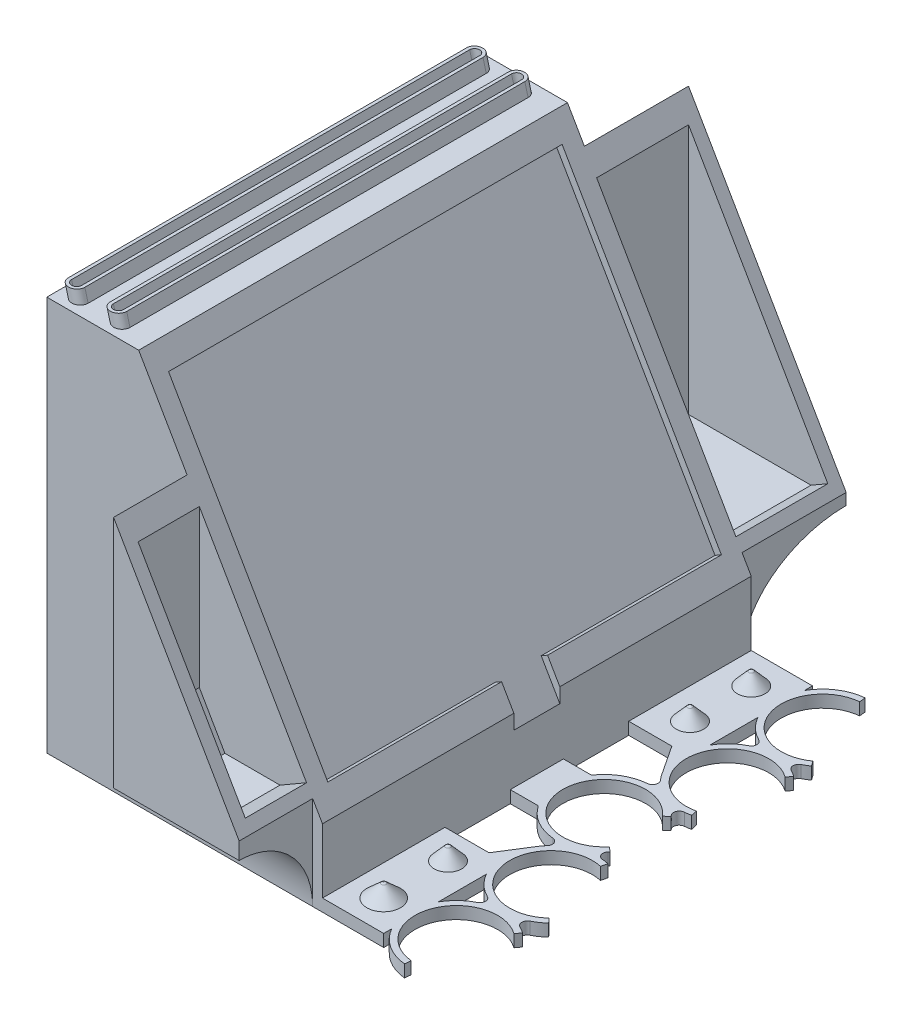
from build123d import *

# Parameters (mm, degrees)
BOSS_EXTRUDE1_DEPTH  = 140
CUT_EXTRUDE1_DEPTH   = 2.4
BOSS_EXTRUDE2_DEPTH  = 30
BOSS_EXTRUDE3_DEPTH  = 4
BOSS_EXTRUDE4_DEPTH  = 20
BOSS_EXTRUDE7_DEPTH  = 4
BOSS_EXTRUDE5_REACH  = 229.194
SKETCH6_W            = 41
SKETCH6_H            = 24
BOSS_EXTRUDE6_REACH  = 229.194
SKETCH7_W            = 51.473720558
SKETCH7_H            = 34
SKETCH12_RX          = 25
SKETCH12_RY          = 24
SKETCH12_RX_2        = 34
SKETCH12_RY_2        = 26.5
CUT_EXTRUDE3_DEPTH   = 80
SKETCH13_W           = 20
SKETCH13_H           = 40
BOSS_EXTRUDE9_DEPTH  = 4
SKETCH15_R           = 5.5
SKETCH15_R_2         = 4.5
BOSS_EXTRUDE11_DEPTH = 4.5
FILLET2_R            = 1
SKETCH22_W           = 35.526279442
SKETCH22_H           = 17.579224782
BOSS_EXTRUDE12_DEPTH = 10
CUT_EXTRUDE4_REACH   = 256.251
BOSS_EXTRUDE13_REACH = 256.251
SKETCH24_W           = 45.956632922
SKETCH24_H           = 155.115839264
CUT_EXTRUDE5_DEPTH   = 6
SKETCH25_W           = 35.526279442
SKETCH25_H           = 17.579224782
CUT_EXTRUDE6_DEPTH   = 10
BOSS_EXTRUDE14_DEPTH = 4


with BuildPart() as part:
    # Sketch1 → Boss-Extrude1 (new body)
    with BuildSketch(Plane.XY):
        Polygon((0, 0), (90, 0), (90, 25), (30, 128.923048454), (0, 128.923048454), align=None)
    extrude(amount=BOSS_EXTRUDE1_DEPTH)

    # Sketch2 → Cut-Extrude1 (cut)
    with BuildSketch(Plane(origin=(78.325317547, 45.22114317, 0), x_dir=(0, 0, -1), z_dir=(0.8660254037844362, 0.5000000000000046, 0))):
        Polygon((-5.75, 88.650635095), (-134.25, 88.650635095), (-134.25, -15.349364905), (-77.5, -15.349364905), (-77.5, -30.349364905), (-62.5, -30.349364905), (-62.5, -15.349364905), (-5.75, -15.349364905), align=None)
    extrude(amount=-CUT_EXTRUDE1_DEPTH, mode=Mode.SUBTRACT)

    # Sketch3 → Boss-Extrude2 (add)
    with BuildSketch(Plane(origin=(0, 0, 0), x_dir=(-1, 0, 0), z_dir=(0, 0, -1))):
        Polygon((-85, 33.660254038), (-79.526279442, 30.5), (-39.526279442, 30.5), (-39.526279442, 112.423048454), (-35.526279442, 119.351251684), (-35.526279442, 112.423048454), (-35.526279442, 26.5), (-80.598076211, 26.5), (-87, 30.196152423), align=None)
    extrude(amount=BOSS_EXTRUDE2_DEPTH)

    # Sketch4 → Boss-Extrude3 (add)
    with BuildSketch(Plane(origin=(0, 0, -30), x_dir=(-1, 0, 0), z_dir=(0, 0, -1))):
        Polygon((-87, 30.196152423), (-35.526279442, 119.351251684), (-35.526279442, 26.5), (-80.598076211, 26.5), align=None)
    extrude(amount=BOSS_EXTRUDE3_DEPTH)

    # Sketch5 → Boss-Extrude4 (add)
    with BuildSketch(Plane.XY.offset(140)):
        Polygon((84.803847577, 34), (76.143593539, 29), (58.143593539, 29), (49.803847577, 43.444863729), (49.803847577, 94.621778265), (45.803847577, 101.549981495), (45.803847577, 94.621778265), (45.803847577, 42.373066959), (55.834192463, 25), (77.215390309, 25), (86.803847577, 30.535898385), align=None)
    extrude(amount=BOSS_EXTRUDE4_DEPTH)

    # Sketch9 → Boss-Extrude7 (add)
    with BuildSketch(Plane.XY.offset(160)):
        Polygon((45.803847577, 101.549981495), (45.803847577, 42.373066959), (55.834192463, 25), (77.215390309, 25), (86.803847577, 30.535898385), align=None)
    extrude(amount=BOSS_EXTRUDE7_DEPTH)

    # Sketch6 → Boss-Extrude5 (add, up to next)
    with BuildSketch(Plane(origin=(0, 0, 0), x_dir=(-1, 0, 0), z_dir=(0, -1, 0)), mode=Mode.PRIVATE) as boss_extrude5_sk1:
        with Locations((-66.303847577, -152)):
            Rectangle(SKETCH6_W, SKETCH6_H)
    boss_extrude5_tool1 = extrude(boss_extrude5_sk1.sketch, amount=-BOSS_EXTRUDE5_REACH, mode=Mode.PRIVATE) - part.part
    add(boss_extrude5_tool1.solids().sort_by_distance((66.303848, 0, 152))[0])

    # Sketch7 → Boss-Extrude6 (add, up to next)
    with BuildSketch(Plane.XZ, mode=Mode.PRIVATE) as boss_extrude6_sk1:
        with Locations((61.263139721, -17)):
            Rectangle(SKETCH7_W, SKETCH7_H)
    boss_extrude6_tool1 = extrude(boss_extrude6_sk1.sketch, amount=-BOSS_EXTRUDE6_REACH, mode=Mode.PRIVATE) - part.part
    add(boss_extrude6_tool1.solids().sort_by_distance((61.26314, 0, -17))[0])

    # Sketch12 → Cut-Extrude3 (cut)
    with BuildSketch(Plane(origin=(90, 0, 0), x_dir=(0, 0, -1), z_dir=(1, 0, 0))):
        with Locations(Location((-164, 0), (0, 0, 90))):
            Ellipse(SKETCH12_RX, SKETCH12_RY)
        with Locations(Location((34, 0), (0, 0, 180))):
            Ellipse(SKETCH12_RX_2, SKETCH12_RY_2)
    extrude(amount=-CUT_EXTRUDE3_DEPTH, mode=Mode.SUBTRACT)

    # Sketch13 → Boss-Extrude9 (add)
    with BuildSketch(Plane(origin=(0, 0, 0), x_dir=(1, 0, 0), z_dir=(0, 1, 0))):
        with Locations((100, -120)):
            Rectangle(SKETCH13_W, SKETCH13_H)
        with Locations((100, -20)):
            Rectangle(SKETCH13_W, SKETCH13_H)
    extrude(amount=BOSS_EXTRUDE9_DEPTH)

    # Sketch15 → Boss-Extrude11 (add)
    with BuildSketch(Plane(origin=(0, 4, 0), x_dir=(1, 0, 0), z_dir=(0, 1, 0))):
        with Locations((100, -130)):
            Circle(SKETCH15_R)
        with Locations((100, -109)):
            Circle(SKETCH15_R_2)
        with Locations((100, -30)):
            Circle(SKETCH15_R_2)
        with Locations((100, -10)):
            Circle(SKETCH15_R_2)
    extrude(amount=BOSS_EXTRUDE11_DEPTH)

    # Sketch16 → Cut-Revolve3 (revolve, cut)
    with BuildSketch(Plane.XY.offset(130)):
        Polygon((100.5, 8.5), (105.5, 4), (105.5, 8.5), align=None)
    revolve(axis=Axis((100, 8.5, 130), (0, -1, 0)), mode=Mode.SUBTRACT)

    # Sketch18 → Cut-Revolve4 (revolve, cut)
    with BuildSketch(Plane(origin=(0, 0, 109), x_dir=(-1, 0, 0), z_dir=(0, 0, -1))):
        Polygon((-104.5, 8.5), (-104.5, 4), (-100.5, 8.5), align=None)
    revolve(axis=Axis((100, 8.5, 109), (0, -1, 0)), mode=Mode.SUBTRACT)

    # Sketch19 → Cut-Revolve7 (revolve, cut)
    with BuildSketch(Plane.XY.offset(30)):
        Polygon((104.5, 8.5), (104.5, 4), (100.5, 8.5), align=None)
    revolve(axis=Axis((100, 8.5, 30), (0, -1, 0)), mode=Mode.SUBTRACT)

    # Sketch20 → Cut-Revolve8 (revolve, cut)
    with BuildSketch(Plane(origin=(0, 0, 10), x_dir=(-1, 0, 0), z_dir=(0, 0, -1))):
        Polygon((-104.5, 8.5), (-104.5, 4), (-100.5, 8.5), align=None)
    revolve(axis=Axis((100, 8.5, 10), (0, -1, 0)), mode=Mode.SUBTRACT)

    # Fillet2
    fillet2_edges = [part.edges().sort_by_distance(p)[0] for p in [
        (99.5, 8.5, 130),
        (99.5, 8.5, 109),
        (99.5, 8.5, 30),
        (99.5, 8.5, 10),
    ]]
    fillet(fillet2_edges, radius=FILLET2_R)

    # Sketch22 → Boss-Extrude12 (add)
    with BuildSketch(Plane(origin=(0, 0, 0), x_dir=(-1, 0, 0), z_dir=(0, 0, -1))):
        with Locations((-17.763139721, 117.133436063)):
            Rectangle(SKETCH22_W, SKETCH22_H)
    extrude(amount=BOSS_EXTRUDE12_DEPTH)

    # Cut-Extrude4: up to this plane
    cut_extrude4_end = Plane(origin=(35.526279442, 125.923048454, -10), z_dir=(0, -1, 0))
    # Sketch21 → Cut-Extrude4 (cut, up to the surface)
    with BuildSketch(Plane(origin=(-34.730762114, 129.616968793, 0), x_dir=(0, 0, 1), z_dir=(-0.25881904510252135, 0.9659258262890681, 0)), mode=Mode.PRIVATE) as cut_extrude4_sk1:
        with BuildLine():
            Line((135, 50.567740293), (5, 50.567740293))
            ThreePointArc((5, 50.567740293), (3.4, 52.167740293), (5, 53.767740293))
            Line((5, 53.767740293), (135, 53.767740293))
            ThreePointArc((135, 53.767740293), (136.6, 52.167740293), (135, 50.567740293))
        make_face()
    cut_extrude4_tool1 = split(extrude(cut_extrude4_sk1.sketch, amount=-CUT_EXTRUDE4_REACH, mode=Mode.PRIVATE), bisect_by=cut_extrude4_end, keep=Keep.BOTH, mode=Mode.PRIVATE)
    add(cut_extrude4_tool1.solids().sort_by_distance((15.659406, 143.118974, 70))[0], mode=Mode.SUBTRACT)
    # Sketch21 → Cut-Extrude4 (cut, up to the surface)
    with BuildSketch(Plane(origin=(-34.730762114, 129.616968793, 0), x_dir=(0, 0, 1), z_dir=(-0.25881904510252135, 0.9659258262890681, 0)), mode=Mode.PRIVATE) as cut_extrude4_sk2:
        with BuildLine():
            Line((135, 37.367740293), (5, 37.367740293))
            ThreePointArc((5, 37.367740293), (3.4, 38.967740293), (5, 40.567740293))
            Line((5, 40.567740293), (135, 40.567740293))
            ThreePointArc((135, 40.567740293), (136.6, 38.967740293), (135, 37.367740293))
        make_face()
    cut_extrude4_tool2 = split(extrude(cut_extrude4_sk2.sketch, amount=-CUT_EXTRUDE4_REACH, mode=Mode.PRIVATE), bisect_by=cut_extrude4_end, keep=Keep.BOTH, mode=Mode.PRIVATE)
    add(cut_extrude4_tool2.solids().sort_by_distance((2.909185, 139.702562, 70))[0], mode=Mode.SUBTRACT)

    # Boss-Extrude13: up to this plane
    boss_extrude13_end = Plane(origin=(30, 128.923048454, 140), z_dir=(0, -1, 0))
    # Sketch21<4> → Boss-Extrude13 (add, up to the surface)
    with BuildSketch(Plane(origin=(-34.730762114, 129.616968793, 0), x_dir=(0, 0, 1), z_dir=(-0.25881904510252135, 0.9659258262890681, 0)), mode=Mode.PRIVATE) as boss_extrude13_sk1:
        with BuildLine():
            Line((135, 49.567740293), (5, 49.567740293))
            ThreePointArc((5, 49.567740293), (2.4, 52.167740293), (5, 54.767740293))
            Line((5, 54.767740293), (135, 54.767740293))
            ThreePointArc((135, 54.767740293), (137.6, 52.167740293), (135, 49.567740293))
        make_face()
        with BuildLine():
            Line((135, 50.567740293), (5, 50.567740293))
            ThreePointArc((5, 50.567740293), (3.4, 52.167740293), (5, 53.767740293))
            Line((5, 53.767740293), (135, 53.767740293))
            ThreePointArc((135, 53.767740293), (136.6, 52.167740293), (135, 50.567740293))
        make_face(mode=Mode.SUBTRACT)
    boss_extrude13_tool1 = split(extrude(boss_extrude13_sk1.sketch, amount=-BOSS_EXTRUDE13_REACH, mode=Mode.PRIVATE), bisect_by=boss_extrude13_end, keep=Keep.BOTH, mode=Mode.PRIVATE)
    add(boss_extrude13_tool1.solids().sort_by_distance((13.278688, 142.481062, 70))[0])
    # Sketch21<4> → Boss-Extrude13 (add, up to the surface)
    with BuildSketch(Plane(origin=(-34.730762114, 129.616968793, 0), x_dir=(0, 0, 1), z_dir=(-0.25881904510252135, 0.9659258262890681, 0)), mode=Mode.PRIVATE) as boss_extrude13_sk2:
        with BuildLine():
            Line((135, 36.367740293), (5, 36.367740293))
            ThreePointArc((5, 36.367740293), (2.4, 38.967740293), (5, 41.567740293))
            Line((5, 41.567740293), (135, 41.567740293))
            ThreePointArc((135, 41.567740293), (137.6, 38.967740293), (135, 36.367740293))
        make_face()
        with BuildLine():
            Line((135, 37.367740293), (5, 37.367740293))
            ThreePointArc((5, 37.367740293), (3.4, 38.967740293), (5, 40.567740293))
            Line((5, 40.567740293), (135, 40.567740293))
            ThreePointArc((135, 40.567740293), (136.6, 38.967740293), (135, 37.367740293))
        make_face(mode=Mode.SUBTRACT)
    boss_extrude13_tool2 = split(extrude(boss_extrude13_sk2.sketch, amount=-BOSS_EXTRUDE13_REACH, mode=Mode.PRIVATE), bisect_by=boss_extrude13_end, keep=Keep.BOTH, mode=Mode.PRIVATE)
    add(boss_extrude13_tool2.solids().sort_by_distance((2.909185, 139.702562, 137.4647))[0])

    # Sketch24 → Cut-Extrude5 (cut, symmetric)
    with BuildSketch(Plane(origin=(0, 138.923048454, 0), x_dir=(1, 0, 0), z_dir=(0, 1, 0))):
        with Locations((16.889922099, -67.225133849)):
            Rectangle(SKETCH24_W, SKETCH24_H)
    extrude(amount=CUT_EXTRUDE5_DEPTH, both=True, mode=Mode.SUBTRACT)

    # Sketch25 → Cut-Extrude6 (cut)
    with BuildSketch(Plane(origin=(0, 0, -10), x_dir=(-1, 0, 0), z_dir=(0, 0, -1))):
        with Locations((-17.763139721, 117.133436063)):
            Rectangle(SKETCH25_W, SKETCH25_H)
    extrude(amount=-CUT_EXTRUDE6_DEPTH, mode=Mode.SUBTRACT)

    # Sketch26 → Boss-Extrude14 (add)
    with BuildSketch(Plane(origin=(0, 0, 0), x_dir=(1, 0, 0), z_dir=(0, 1, 0))):
        with BuildLine():
            Line((134, -110.136208092), (132.636888262, -108.672675929))
            ThreePointArc((132.636888262, -108.672675929), (110.411683531, -102.31131403), (126.426302322, -85.639222514))
            Line((126.426302322, -85.639222514), (126.868901091, -83.688810678))
            ThreePointArc((126.868901091, -83.688810678), (125.824830864, -83.489274264), (124.769536388, -83.361794908))
            ThreePointArc((124.769536388, -83.361794908), (123.2239842, -82.21277902), (123.559758778, -80.316407614))
            ThreePointArc((123.559758778, -80.316407614), (123.715691479, -80.138977377), (123.868901091, -79.959190528))
            Line((123.868901091, -79.959190528), (122.336812204, -78.673615308))
            ThreePointArc((122.336812204, -78.673615308), (98.50625, -70), (122.336812204, -61.326384692))
            Line((122.336812204, -61.326384692), (123.868901091, -60.040809472))
            ThreePointArc((123.868901091, -60.040809472), (123.715691479, -59.861022623), (123.559758778, -59.683592386))
            ThreePointArc((123.559758778, -59.683592386), (123.2239842, -57.78722098), (124.769536388, -56.638205092))
            ThreePointArc((124.769536388, -56.638205092), (125.824830864, -56.510725736), (126.868901091, -56.311189322))
            Line((126.868901091, -56.311189322), (126.426302322, -54.360777486))
            ThreePointArc((126.426302322, -54.360777486), (110.217926033, -38.508221598), (131.335834877, -30.259044901))
            Line((131.335834877, -30.259044901), (132.506108688, -28.637175853))
            ThreePointArc((132.506108688, -28.637175853), (131.4778091, -27.955754608), (130.398558143, -27.358299731))
            ThreePointArc((130.398558143, -27.358299731), (129.389226735, -25.718110965), (130.404226921, -24.08142416))
            ThreePointArc((130.404226921, -24.08142416), (131.476043169, -23.49341928), (132.498163344, -22.822740402))
            Line((132.498163344, -22.822740402), (131.335834877, -21.195167813))
            ThreePointArc((131.335834877, -21.195167813), (110.857209749, -14.94691192), (122.192819685, 3.216753355))
            Line((122.192819685, 3.216753355), (122, 5.207436798))
            ThreePointArc((122, 5.207436798), (108.263257374, -7.370130657), (116.535335614, -24.057431897))
            ThreePointArc((116.535335614, -24.057431897), (117.544667022, -25.697620662), (116.529666836, -27.334307467))
            ThreePointArc((116.529666836, -27.334307467), (110.592182978, -32.542135782), (107.993057811, -40))
            Line((107.993057811, -40), (104.075667874, -40))
            Line((104.075667874, -40), (110.513401907, -49.742999668))
            ThreePointArc((110.513401907, -49.742999668), (111.16476861, -50.655240288), (111.880384979, -51.518000244))
            ThreePointArc((111.880384979, -51.518000244), (112.216159557, -53.41437165), (110.670607369, -54.563387538))
            ThreePointArc((110.670607369, -54.563387538), (104.150403381, -56.641851851), (99.161593302, -61.326384692))
            Line((99.161593302, -61.326384692), (90, -61.326384692))
            Line((90, -61.326384692), (90, -78.673615308))
            Line((90, -78.673615308), (99.161593302, -78.673615308))
            ThreePointArc((99.161593302, -78.673615308), (104.150403381, -83.358148149), (110.670607369, -85.436612462))
            ThreePointArc((110.670607369, -85.436612462), (112.216159557, -86.58562835), (111.880384979, -88.481999756))
            ThreePointArc((111.880384979, -88.481999756), (111.16476861, -89.344759712), (110.513401907, -90.257000332))
            Line((110.513401907, -90.257000332), (110.145214654, -90.842205436))
            Line((110.145214654, -90.842205436), (104.383502747, -100))
            Line((104.383502747, -100), (107.993057811, -100))
            ThreePointArc((107.993057811, -100), (110.592182978, -107.457864218), (116.529666836, -112.665692533))
            ThreePointArc((116.529666836, -112.665692533), (117.544667022, -114.302379338), (116.535335614, -115.942568103))
            ThreePointArc((116.535335614, -115.942568103), (108.263257374, -132.629869343), (122, -145.207436798))
            Line((122, -145.207436798), (122.192819685, -143.216753355))
            ThreePointArc((122.192819685, -143.216753355), (110.857209749, -125.05308808), (131.335834877, -118.804832187))
            Line((131.335834877, -118.804832187), (132.498163344, -117.177259598))
            ThreePointArc((132.498163344, -117.177259598), (131.476043169, -116.50658072), (130.404226921, -115.91857584))
            ThreePointArc((130.404226921, -115.91857584), (129.389226735, -114.281889035), (130.398558143, -112.641700269))
            ThreePointArc((130.398558143, -112.641700269), (132.288410493, -111.517073371), (134, -110.136208092))
        make_face()
    extrude(amount=BOSS_EXTRUDE14_DEPTH)


solid = part.part
